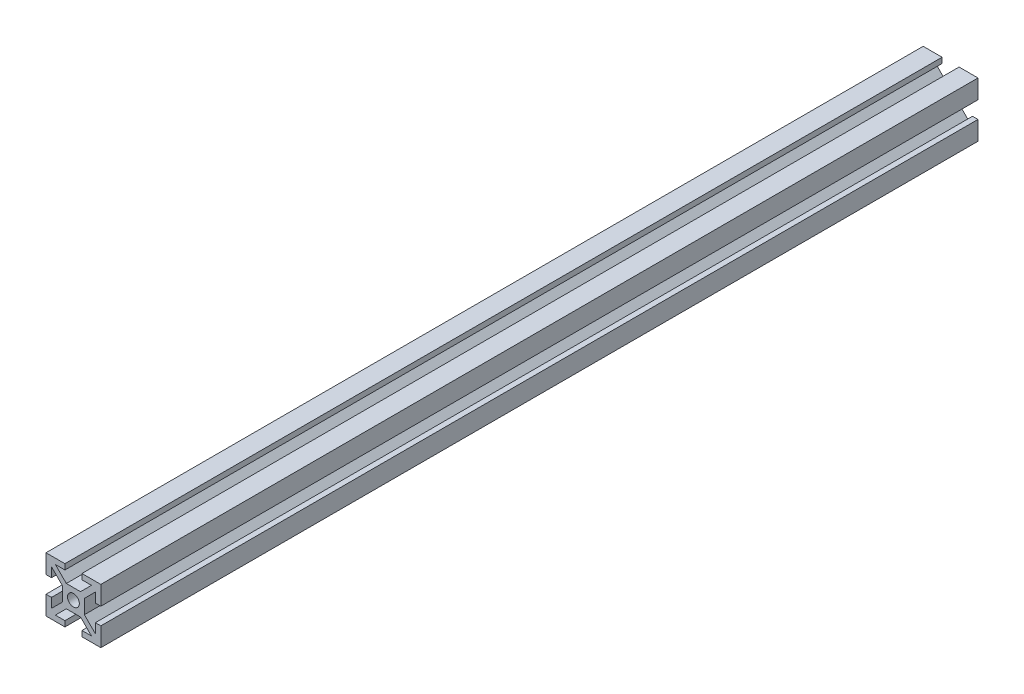
from build123d import *

# Parameters (mm, degrees)
ESQUISSE1_R        = 2.15
BOSS_EXTRU_1_DEPTH = 320


with BuildPart() as part:
    # Esquisse1 → Boss.-Extru.1 (new body)
    with BuildSketch(Plane.XY):
        Polygon((20, 13.1), (18, 13.1), (18, 16.585786438), (14, 12.585786438), (14, 10), (14, 7.414213562), (18, 3.414213562), (18, 6.9), (20, 6.9), (20, 0), (13.1, 0), (13.1, 2), (16.585786438, 2), (12.585786438, 6), (10, 6), (7.414213562, 6), (3.414213562, 2), (6.9, 2), (6.9, 0), (0, 0), (0, 6.9), (2, 6.9), (2, 3.414213562), (6, 7.414213562), (6, 10), (6, 12.585786438), (2, 16.585786438), (2, 13.1), (0, 13.1), (0, 20), (6.9, 20), (6.9, 18), (3.414213562, 18), (7.414213562, 14), (10, 14), (12.585786438, 14), (16.585786438, 18), (13.1, 18), (13.1, 20), (20, 20), align=None)
        with Locations((10, 10)):
            Circle(ESQUISSE1_R, mode=Mode.SUBTRACT)
    extrude(amount=BOSS_EXTRU_1_DEPTH)


solid = part.part
